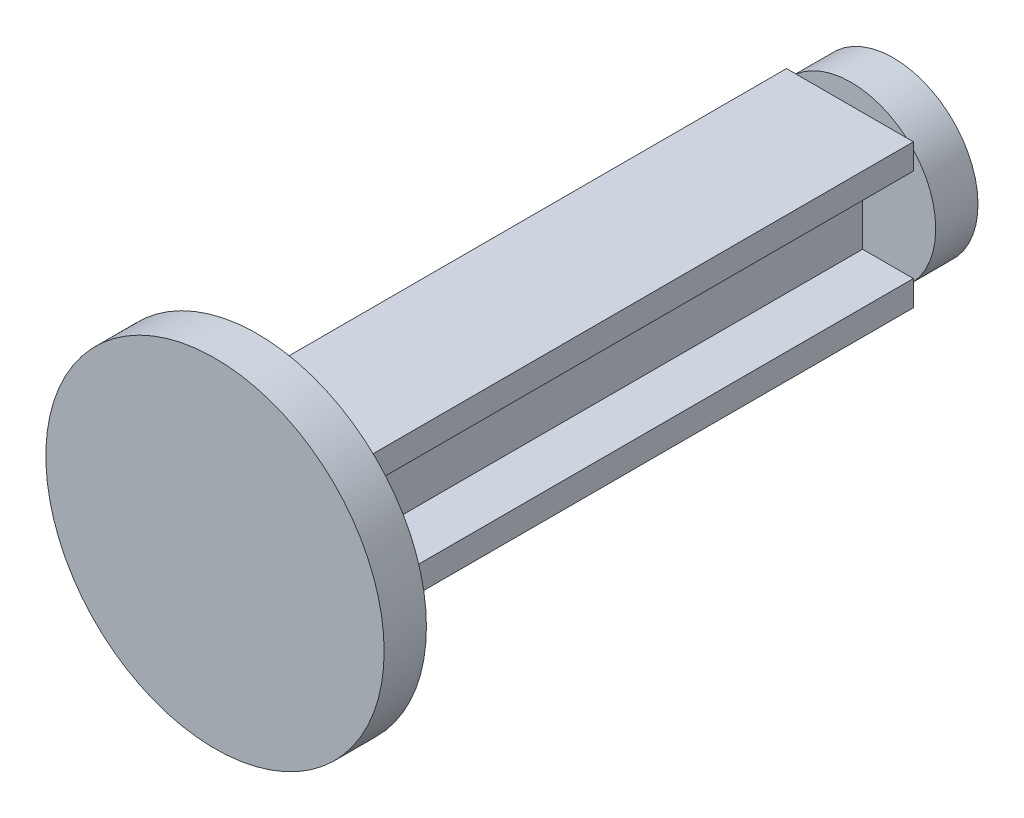
from build123d import *

# Parameters (mm, degrees)
SKETCH4_W           = 30
SKETCH4_H           = 6
SKETCH4_W_2         = 6
SKETCH4_H_2         = 22
BOSS_EXTRUDE1_DEPTH = 140
SKETCH6_R           = 20
BOSS_EXTRUDE2_DEPTH = 10
SKETCH7_R           = 40
BOSS_EXTRUDE3_DEPTH = 10


with BuildPart() as part:
    # Sketch4 → Boss-Extrude1 (new body)
    with BuildSketch(Plane(origin=(1.761790339, -4.428283824, 0), x_dir=(1, 0, 0), z_dir=(0, 0, 1))):
        with Locations((-10.641284089, 16.5928688)):
            Rectangle(SKETCH4_W, SKETCH4_H)
        with Locations((-10.641284089, 2.5928688)):
            Rectangle(SKETCH4_W_2, SKETCH4_H_2)
        with Locations((-10.641284089, -11.4071312)):
            Rectangle(SKETCH4_W, SKETCH4_H)
    extrude(amount=BOSS_EXTRUDE1_DEPTH)

    # Sketch6 → Boss-Extrude2 (add)
    with BuildSketch(Plane(origin=(0, 0, 0), x_dir=(-1, 0, 0), z_dir=(0, 0, -1))):
        with Locations(Location((8.59379802, 0, 0), (0, 0, 137.367685303))):
            Circle(SKETCH6_R)
    extrude(amount=BOSS_EXTRUDE2_DEPTH)

    # Sketch7 → Boss-Extrude3 (add)
    with BuildSketch(Plane.XY.offset(140)):
        with Locations((-9.032018986, -1.718473877)):
            Circle(SKETCH7_R)
    extrude(amount=BOSS_EXTRUDE3_DEPTH)


solid = part.part
